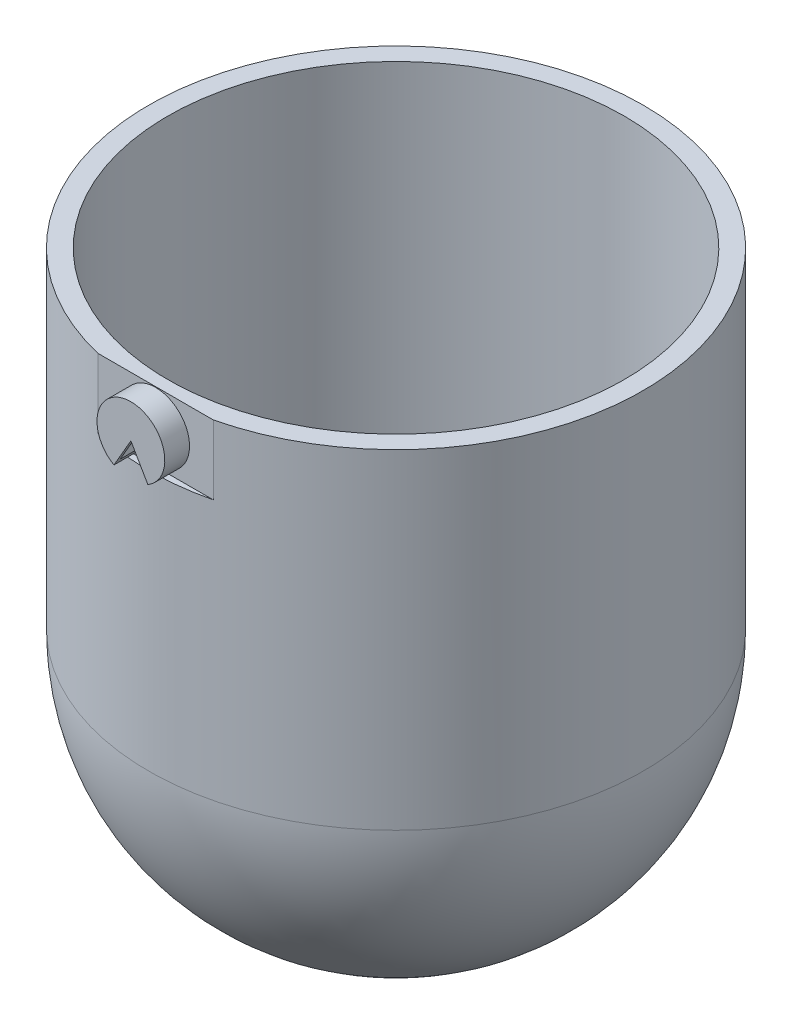
from build123d import *

# Parameters (mm, degrees)
CUT_EXTRUDE2_DEPTH      = 75.053089065
CUT_EXTRUDE2_DEPTH_BACK = 75.053089065
SKETCH6_R               = 0.798586054
SKETCH6_R_2             = 0.898409311
SKETCH6_R_3             = 1.301536031
SKETCH6_R_4             = 1.450875321
SKETCH6_R_5             = 1.45516152
SKETCH6_R_6             = 1.218498135
SKETCH6_R_7             = 1.347613966
SKETCH6_R_8             = 1.447437223
SKETCH6_R_9             = 1.586216364
SKETCH6_R_10            = 2.201735818
SKETCH6_R_11            = 2.304598841
SKETCH6_R_12            = 2.501563644
SKETCH6_R_13            = 2.004559367
SKETCH6_R_14            = 2.549404679
SKETCH6_R_15            = 1.816810697
SKETCH6_R_16            = 1.376873583
SKETCH6_R_17            = 1.716785421
SKETCH6_R_18            = 1.665145778
SKETCH6_R_19            = 2.545003671
SKETCH6_R_20            = 2.894443481
SKETCH6_R_21            = 1.457727191
SKETCH6_R_22            = 2.281692115
SKETCH6_R_23            = 1.494379636
SKETCH6_R_24            = 2.147526778
SKETCH6_R_25            = 2.12227155
SKETCH6_R_26            = 0.891996297
SKETCH6_R_27            = 0.99479447
CUT_EXTRUDE16_DEPTH     = 13.208
SKETCH8_R               = 5.225717767
BOSS_EXTRUDE1_DEPTH     = 3.81
CUT_EXTRUDE17_START     = -3.81
CUT_EXTRUDE17_DEPTH     = 3.81
CUT_EXTRUDE18_DEPTH     = 7.62


with BuildPart() as part:
    # Sketch5 → Revolve4 (revolve)
    with BuildSketch(Plane.XY, mode=Mode.PRIVATE) as revolve4_sk:
        with BuildLine():
            Line((-35.179, 0), (-35.179, 50.8))
            Line((-35.179, 50.8), (-38.1, 50.8))
            Line((-38.1, 50.8), (-38.1, 0))
            ThreePointArc((-38.1, 0), (-26.940768363, -26.940768363), (0, -38.1))
            Line((0, -38.1), (0, -35.179))
            ThreePointArc((0, -35.179), (-24.875309455, -24.875309455), (-35.179, 0))
        make_face()
    revolve(revolve4_sk.sketch.rotate(Axis((0, 0, 0), (0, 1, 0)), 270), axis=Axis((0, 0, 0), (0, 1, 0)))

    # Sketch6 → Cut-Extrude2 (cut, two sides: drawn at the far end of the back side and taken through both)
    with BuildSketch(Plane(origin=(0, 0, 0), x_dir=(1, 0, 0), z_dir=(0, 1, 0)).offset(-CUT_EXTRUDE2_DEPTH_BACK)):
        with Locations(Location((-8.979978637, -11.919827854, 0), (0, 0, 127.922452579))):
            Circle(SKETCH6_R)
        with Locations(Location((-11.026355401, 3.752423456, 0), (0, 0, 134.909139335))):
            Circle(SKETCH6_R_2)
        with Locations(Location((0.503230754, -5.531139422, 0), (0, 0, 136.277932039))):
            Circle(SKETCH6_R_3)
        with Locations(Location((5.993509876, 7.795265355, 0), (0, 0, 142.713030261))):
            Circle(SKETCH6_R_4)
        with Locations(Location((-3.339964631, 13.78466076, 0), (0, 0, 232.613718821))):
            Circle(SKETCH6_R_5)
        with Locations(Location((13.979370416, -11.520534827, 0), (0, 0, 136.163412616))):
            Circle(SKETCH6_R_6)
        with Locations(Location((3.547840085, -13.916292989, 0), (0, 0, 136.547851081))):
            Circle(SKETCH6_R_7)
        with Locations(Location((-13.721583333, -5.531139422, 0), (0, 0, 41.066825322))):
            Circle(SKETCH6_R_8)
        with Locations(Location((10.48555643, -1.188827753, 0), (0, 0, 148.716930529))):
            Circle(SKETCH6_R_9)
        with Locations(Location((-11.575383313, 12.32949924, 0), (0, 0, 136.174831863))):
            Circle(SKETCH6_R_10)
        with Locations(Location((-3.339964631, 1.007283896, 0), (0, 0, 334.082500722))):
            Circle(SKETCH6_R_11)
        with Locations(Location((-3.339964631, -17.360195347, 0), (0, 0, 124.071125774))):
            Circle(SKETCH6_R_12)
        with Locations(Location((13.330519247, 7.495795585, 0), (0, 0, 223.074599581))):
            Circle(SKETCH6_R_13)
        with Locations(Location((7.444385197, 13.435279362, 0), (0, 0, 140.734073218))):
            Circle(SKETCH6_R_14)
        with Locations(Location((2.200226119, 17.927325916, 0), (0, 0, 228.32671472))):
            Circle(SKETCH6_R_15)
        with Locations(Location((-0.495001813, 7.795265355, 0), (0, 0, 138.637560917))):
            Circle(SKETCH6_R_16)
        with Locations(Location((-4.795126151, 5.948535105, 0), (0, 0, 135.566115588))):
            Circle(SKETCH6_R_17)
        with Locations(Location((-20.709211306, 3.311882737, 0), (0, 0, 139.127560567))):
            Circle(SKETCH6_R_18)
        with Locations(Location((-15.618225212, -12.718413908, 0), (0, 0, 42.839673057))):
            Circle(SKETCH6_R_19)
        with Locations(Location((8.899340066, -9.27451155, 0), (0, 0, 134.981550631))):
            Circle(SKETCH6_R_20)
        with Locations(Location((18.022212315, -4.632730111, 0), (0, 0, 151.333132002))):
            Circle(SKETCH6_R_21)
        with Locations(Location((17.473184403, 0.397388611, 0), (0, 0, 190.030021765))):
            Circle(SKETCH6_R_22)
        with Locations(Location((-14.869550786, 7.665320526, 0), (0, 0, 145.311017094))):
            Circle(SKETCH6_R_23)
        with Locations(Location((-15.618225212, 1.007283896, 0), (0, 0, 332.027607177))):
            Circle(SKETCH6_R_24)
        with Locations(Location((-7.332894901, -4.632730111, 0), (0, 0, 131.693248003))):
            Circle(SKETCH6_R_25)
        with Locations(Location((5.993509876, 0, 0), (0, 0, 179.999999999))):
            Circle(SKETCH6_R_26)
        with Locations(Location((4.542634555, 2.10533972, 0), (0, 0, 124.294003481))):
            Circle(SKETCH6_R_27)
    extrude(amount=CUT_EXTRUDE2_DEPTH + CUT_EXTRUDE2_DEPTH_BACK, mode=Mode.SUBTRACT)

    # Sketch7 → Cut-Extrude16 (cut)
    with BuildSketch(Plane(origin=(0, 53.34, 0), x_dir=(1, 0, 0), z_dir=(0, 1, 0))):
        Polygon((0, -38.1), (8.89, -38.1), (8.89, -37.04831845), (-8.89, -37.04831845), (-8.89, -38.1), align=None)
    extrude(amount=-CUT_EXTRUDE16_DEPTH, mode=Mode.SUBTRACT)

    # Sketch8 → Boss-Extrude1 (add)
    with BuildSketch(Plane.XY.offset(37.04831845)):
        with Locations(Location((0, 45.466, 0), (0, 0, 180))):
            Circle(SKETCH8_R)
    extrude(amount=BOSS_EXTRUDE1_DEPTH)

    # Sketch9 → Cut-Extrude17 (cut)
    with BuildSketch(Plane.XY.offset(40.85831845).offset(CUT_EXTRUDE17_START)):
        with BuildLine():
            Line((0, 45.466), (2.612858884, 40.94039566))
            ThreePointArc((2.612858884, 40.94039566), (0, 40.240282233), (-2.612858884, 40.94039566))
            Line((-2.612858884, 40.94039566), (0, 45.466))
        make_face()
    extrude(amount=CUT_EXTRUDE17_DEPTH, mode=Mode.SUBTRACT)

    # Sketch10 → Cut-Extrude18 (cut)
    with BuildSketch(Plane(origin=(0, 40.132, 0), x_dir=(1, 0, 0), z_dir=(0, 1, 0))):
        Polygon((0, -37.001638613), (1.940594324, -37.001638613), (1.940594324, -40.303638613), (-2.212812538, -40.303638613), (-2.212812538, -37.04831845), align=None)
    extrude(amount=CUT_EXTRUDE18_DEPTH, mode=Mode.SUBTRACT)


solid = part.part
